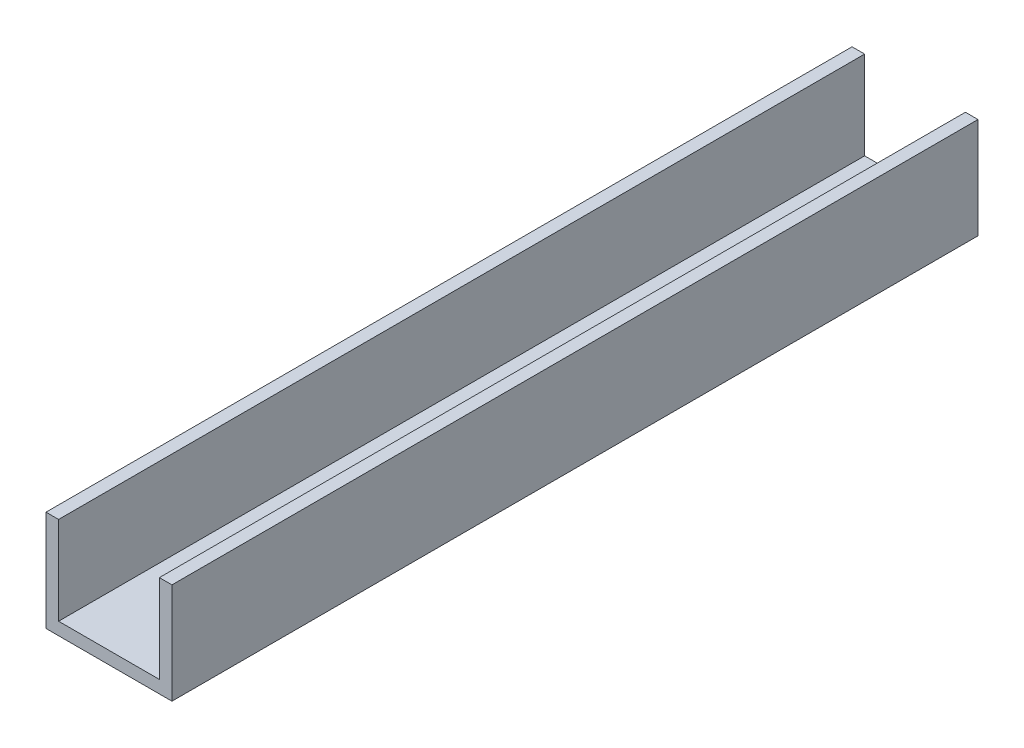
from build123d import *

# Parameters (mm, degrees)
BOSS_EXTRUDE2_DEPTH  = 609.6
CUT_EXTRUDE1_DEPTH   = 1016
M6_CLEARANCE_HOLE1_D = 6.4


with BuildPart() as part:
    # Sketch3 → Boss-Extrude2 (new, symmetric)
    with BuildSketch(Plane.XY):
        Polygon((-15.875, 12.7), (-15.875, -12.7), (15.875, -12.7), (15.875, 12.7), (12.7, 12.7), (12.7, -9.525), (-12.7, -9.525), (-12.7, 12.7), align=None)
    extrude(amount=BOSS_EXTRUDE2_DEPTH, both=True)

    # Sketch5 → Cut-Extrude1 (cut)
    with BuildSketch(Plane.XY.offset(609.6)):
        Polygon((-15.875, 12.7), (-12.7, 12.7), (-12.7, -9.525), (12.7, -9.525), (12.7, 12.7), (15.875, 12.7), (15.875, -12.7), (-15.875, -12.7), align=None)
    extrude(amount=-CUT_EXTRUDE1_DEPTH, mode=Mode.SUBTRACT)

    # M6 Clearance Hole1 (through all)
    with Locations(Plane(origin=(0, -9.525, 0), x_dir=(1, 0, 0), z_dir=(0, 1, 0))):
        with Locations((0, 594.6)):
            Hole(M6_CLEARANCE_HOLE1_D / 2)


solid = part.part
